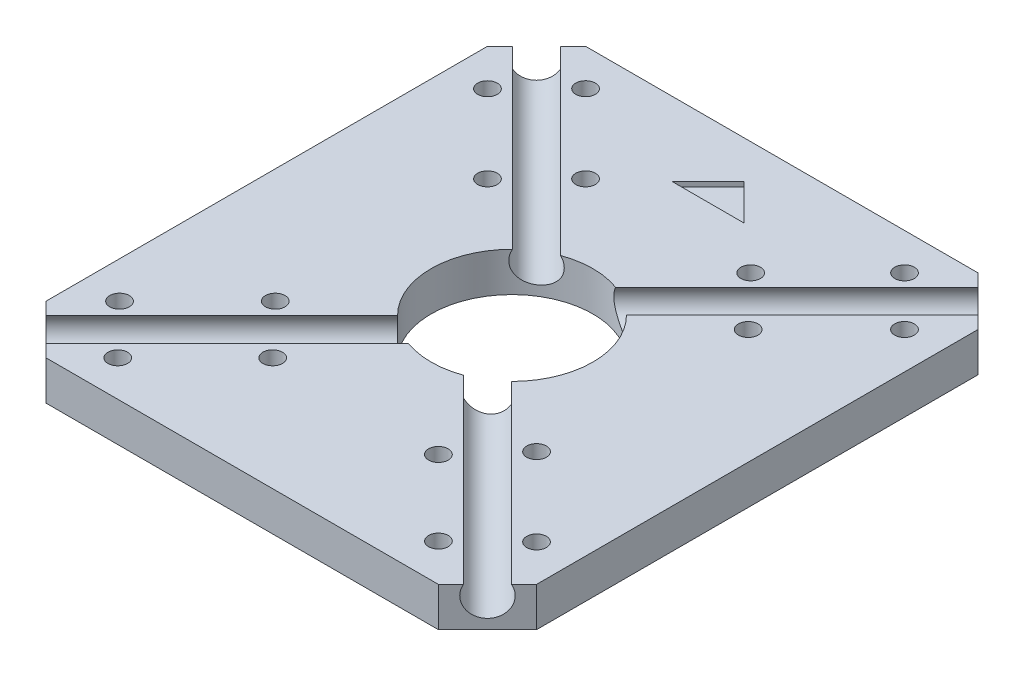
from build123d import *

# Parameters (mm, degrees)
EXTRUDE_1_DEPTH     = 8
SKETCH_3_R          = 16.5
CUT_EXTRUDE_1_DEPTH = 8
SKETCH_2_R          = 4
CUT_EXTRUDE_2_DEPTH = 60
SKETCH_4_R          = 4
CUT_EXTRUDE_3_DEPTH = 60
SKETCH_5_R          = 4
CUT_EXTRUDE_4_DEPTH = 60
SKETCH_6_R          = 4
CUT_EXTRUDE_5_DEPTH = 60
CUT_EXTRUDE_6_DEPTH = 1
SKETCH_8_R          = 2
CUT_EXTRUDE_8_DEPTH = 9


with BuildPart() as part:
    # 草图1 → 凸台-拉伸1 (new body)
    with BuildSketch(Plane(origin=(0, 0, 0), x_dir=(1, 0, 0), z_dir=(0, 1, 0))):
        Polygon((-40, 55), (-50, 45), (-50, -45), (-40, -55), (40, -55), (50, -45), (50, 45), (40, 55), align=None)
    extrude(amount=EXTRUDE_1_DEPTH)

    # 草图3 → 切除-拉伸1 (cut)
    with BuildSketch(Plane(origin=(0, 8, 0), x_dir=(1, 0, 0), z_dir=(0, 1, 0))):
        with Locations(Location((0, 0, 0), (0, 0, 270))):
            Circle(SKETCH_3_R)
    extrude(amount=-CUT_EXTRUDE_1_DEPTH, mode=Mode.SUBTRACT)

    # 草图2 → 切除-拉伸2 (cut)
    with BuildSketch(Plane(origin=(47.5, 0, 47.5), x_dir=(0.7071067811865483, 0, -0.7071067811865468), z_dir=(0.7071067811865468, 0, 0.7071067811865483))):
        with Locations((-3.535533906, 6)):
            Circle(SKETCH_2_R)
    extrude(amount=-CUT_EXTRUDE_2_DEPTH, mode=Mode.SUBTRACT)

    # 草图4 → 切除-拉伸3 (cut)
    with BuildSketch(Plane(origin=(-47.5, 0, 47.5), x_dir=(0.7071067811865475, 0, 0.7071067811865477), z_dir=(-0.7071067811865477, 0, 0.7071067811865475))):
        with Locations((3.535533906, 6)):
            Circle(SKETCH_4_R)
    extrude(amount=-CUT_EXTRUDE_3_DEPTH, mode=Mode.SUBTRACT)

    # 草图5 → 切除-拉伸4 (cut)
    with BuildSketch(Plane(origin=(-47.5, 0, -47.5), x_dir=(-0.7071067811865477, 0, 0.7071067811865475), z_dir=(-0.7071067811865475, 0, -0.7071067811865477))):
        with Locations((-3.535533906, 6)):
            Circle(SKETCH_5_R)
    extrude(amount=-CUT_EXTRUDE_4_DEPTH, mode=Mode.SUBTRACT)

    # 草图6 → 切除-拉伸5 (cut)
    with BuildSketch(Plane(origin=(47.5, 0, -47.5), x_dir=(-0.7071067811865475, 0, -0.7071067811865477), z_dir=(0.7071067811865477, 0, -0.7071067811865475))):
        with Locations((3.535533906, 6)):
            Circle(SKETCH_6_R)
    extrude(amount=-CUT_EXTRUDE_5_DEPTH, mode=Mode.SUBTRACT)

    # 草图7 → 切除-拉伸6 (cut)
    with BuildSketch(Plane(origin=(0, 8, 0), x_dir=(1, 0, 0), z_dir=(0, 1, 0))):
        Polygon((0, 47.334494774), (-7.385524007, 39.948970766), (7.385524007, 39.948970766), align=None)
    extrude(amount=-CUT_EXTRUDE_6_DEPTH, mode=Mode.SUBTRACT)

    # 草图8 → 切除-拉伸8 (cut)
    with BuildSketch(Plane(origin=(0, 8, 0), x_dir=(1, 0, 0), z_dir=(0, 1, 0))):
        with Locations(Location((-32.511046196, 47.511046196, 0), (0, 0, 270))):
            Circle(SKETCH_8_R)
        with Locations(Location((-42.504921706, 37.504921706, 0), (0, 0, 270))):
            Circle(SKETCH_8_R)
        with Locations(Location((-16.594623736, 31.594623736, 0), (0, 0, 270))):
            Circle(SKETCH_8_R)
        with Locations(Location((-26.594623736, 21.594623736, 0), (0, 0, 270))):
            Circle(SKETCH_8_R)
        with Locations(Location((16.828543077, 31.828543077, 0), (0, 0, 270))):
            Circle(SKETCH_8_R)
        with Locations(Location((32.511046196, 47.511046196, 0), (0, 0, 270))):
            Circle(SKETCH_8_R)
        with Locations(Location((42.504921706, 37.504921706, 0), (0, 0, 270))):
            Circle(SKETCH_8_R)
        with Locations(Location((26.57676385, 21.57676385, 0), (0, 0, 270))):
            Circle(SKETCH_8_R)
        with Locations(Location((-26.63034351, -21.63034351, 0), (0, 0, 270))):
            Circle(SKETCH_8_R)
        with Locations(Location((-16.8946096, -31.8946096, 0), (0, 0, 270))):
            Circle(SKETCH_8_R)
        with Locations(Location((-42.504921706, -37.504921706, 0), (0, 0, 270))):
            Circle(SKETCH_8_R)
        with Locations(Location((-32.684358037, -47.684358037, 0), (0, 0, 270))):
            Circle(SKETCH_8_R)
        with Locations(Location((26.558903963, -21.558903963, 0), (0, 0, 270))):
            Circle(SKETCH_8_R)
        with Locations(Location((17.062462418, -32.062462418, 0), (0, 0, 270))):
            Circle(SKETCH_8_R)
        with Locations(Location((42.504921706, -37.504921706, 0), (0, 0, 270))):
            Circle(SKETCH_8_R)
        with Locations(Location((32.355177206, -47.355177206, 0), (0, 0, 270))):
            Circle(SKETCH_8_R)
    extrude(amount=-CUT_EXTRUDE_8_DEPTH, mode=Mode.SUBTRACT)


solid = part.part
